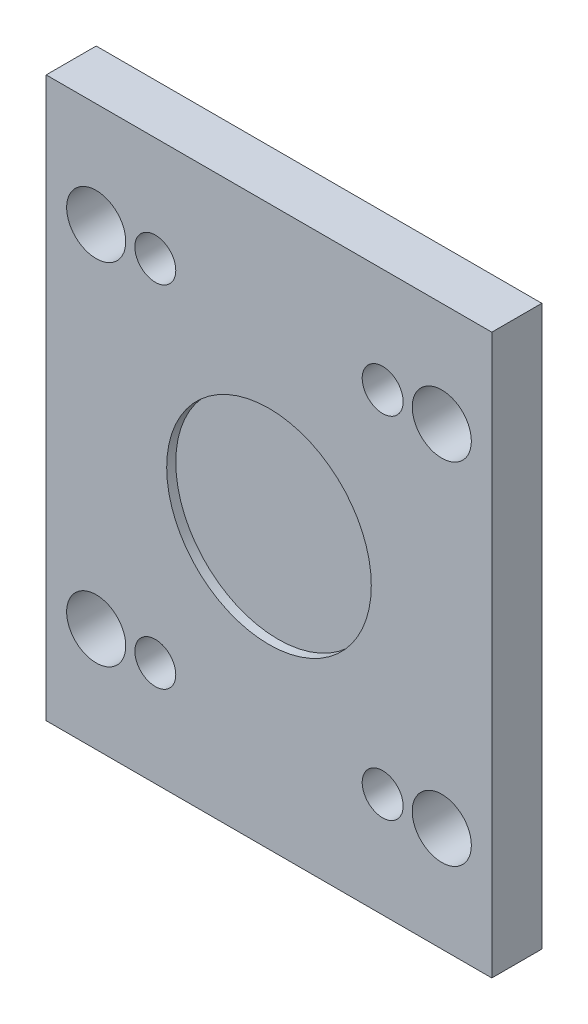
from build123d import *

# Parameters (mm, degrees)
SKETCH_1_W                   = 196
SKETCH_1_H                   = 246
EXTRUDE_1_DEPTH              = 22
HOLE_WIZARD_M101_D           = 11
HOLE_WIZARD_M101_CBORE_D     = 18
HOLE_WIZARD_M101_CBORE_DEPTH = 13
HOLE_WIZARD_M221_D           = 26
HOLE_WIZARD_M801_D           = 90
HOLE_WIZARD_M801_DEPTH       = 4


with BuildPart() as part:
    # Эскиз1 → Бобышка-Вытянуть1 (new body)
    with BuildSketch(Plane.XY.offset(22)):
        Rectangle(SKETCH_1_W, SKETCH_1_H)
    extrude(amount=-EXTRUDE_1_DEPTH)

    # Цековка для  болта с шестигранной головкой M101 (through all)
    with Locations(Plane.XY.offset(22)):
        with Locations((50, 77), (50, -77), (-50, 77), (-50, -77)):
            CounterBoreHole(HOLE_WIZARD_M101_D / 2, HOLE_WIZARD_M101_CBORE_D / 2, HOLE_WIZARD_M101_CBORE_DEPTH)

    # Отверстие с зазором M221 (through all)
    with Locations(Plane.XY.offset(22)):
        with Locations((76, 77), (76, -77), (-76, -77), (-76, 77)):
            Hole(HOLE_WIZARD_M221_D / 2)

    # Отверстие с зазором M801
    with Locations(Plane.XY.offset(22)):
        with Locations((0, 0)):
            Hole(HOLE_WIZARD_M801_D / 2, depth=HOLE_WIZARD_M801_DEPTH)


solid = part.part
